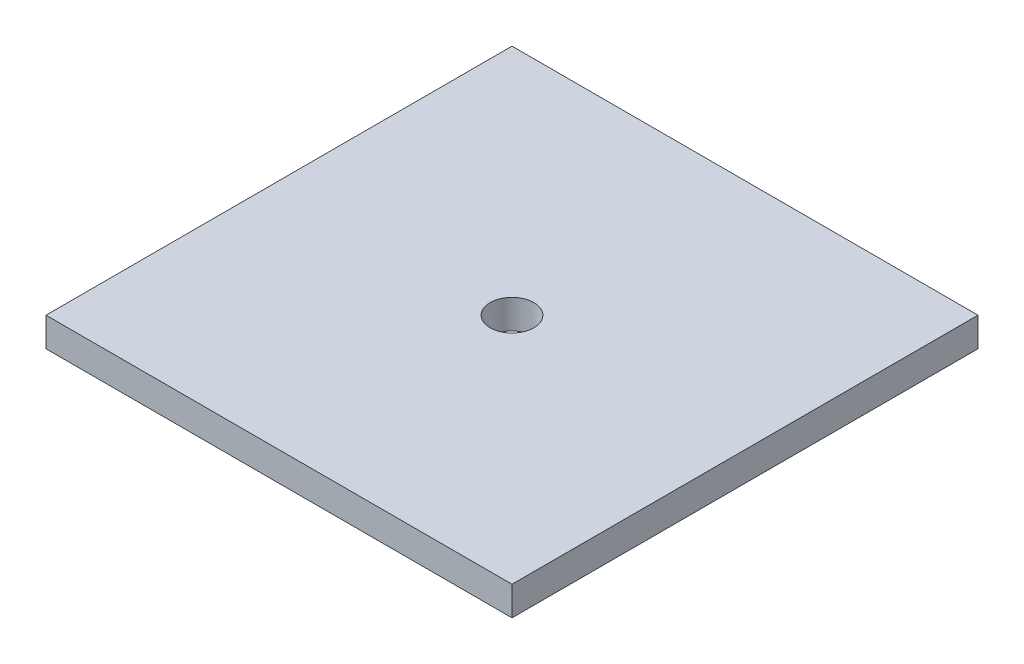
from build123d import *

# Parameters (mm, degrees)
SKETCH1_W           = 203.2
SKETCH1_H           = 203.2
SKETCH1_R           = 9.525
BOSS_EXTRUDE1_DEPTH = 12.7


with BuildPart() as part:
    # Sketch1 → Boss-Extrude1 (new body)
    with BuildSketch(Plane(origin=(0, 0, 0), x_dir=(1, 0, 0), z_dir=(0, 1, 0))):
        Rectangle(SKETCH1_W, SKETCH1_H)
        with Locations(Location((0, 0, 0), (0, 0, 270))):
            Circle(SKETCH1_R, mode=Mode.SUBTRACT)
    extrude(amount=BOSS_EXTRUDE1_DEPTH)


solid = part.part
